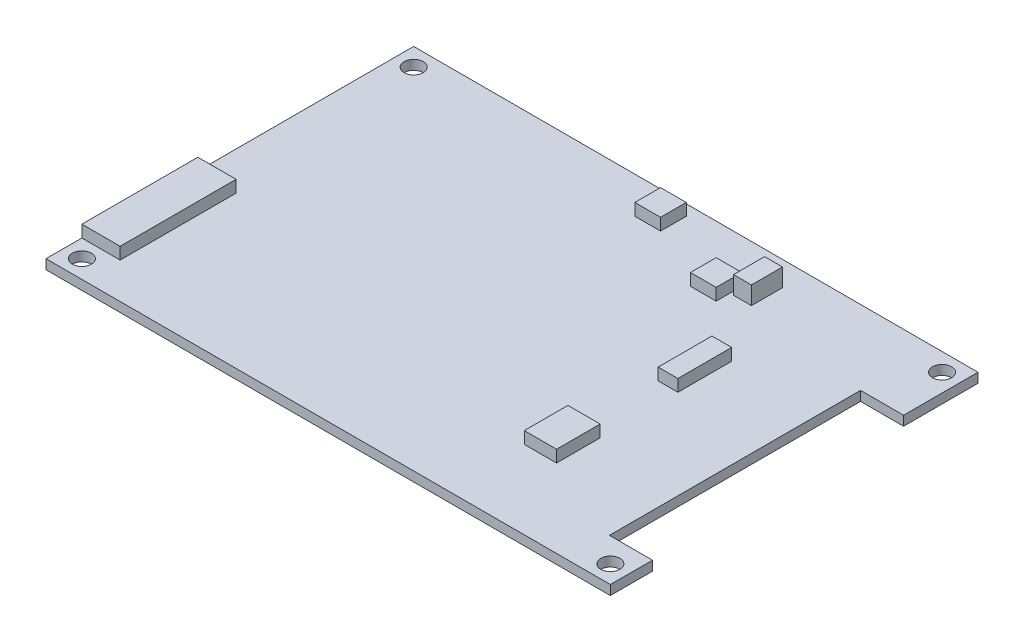
from build123d import *

# Parameters (mm, degrees)
SKETCH_1_R      = 1.6
EXTRUDE_1_DEPTH = 1.6
SKETCH_2_W      = 6.4
SKETCH_2_H      = 19.4
SKETCH_2_W_2    = 5.4
SKETCH_2_H_2    = 7.3
SKETCH_2_W_3    = 3.3
SKETCH_2_H_3    = 9
SKETCH_2_W_4    = 4.3
SKETCH_2_H_4    = 4.3
EXTRUDE_2_DEPTH = 2
SKETCH_3_W      = 3
SKETCH_3_H      = 5.2
EXTRUDE_3_DEPTH = 3


with BuildPart() as part:
    # 草图1 → 凸台-拉伸1 (new body)
    with BuildSketch(Plane(origin=(0, 0, 0), x_dir=(1, 0, 0), z_dir=(0, 1, 0))):
        Polygon((94.4, 0), (0, 0), (0, -61.5), (94.4, -61.5), (94.4, -54.45), (87.2, -54.45), (87.2, -12.45), (94.4, -12.45), align=None)
        with Locations(Location((3, -58.5, 0), (0, 0, 270))):
            Circle(SKETCH_1_R, mode=Mode.SUBTRACT)
        with Locations(Location((91.4, -58.5, 0), (0, 0, 270))):
            Circle(SKETCH_1_R, mode=Mode.SUBTRACT)
        with Locations(Location((3, -3, 0), (0, 0, 270))):
            Circle(SKETCH_1_R, mode=Mode.SUBTRACT)
        with Locations(Location((91.4, -3, 0), (0, 0, 270))):
            Circle(SKETCH_1_R, mode=Mode.SUBTRACT)
    extrude(amount=EXTRUDE_1_DEPTH)

    # 草图2 → 凸台-拉伸2 (add)
    with BuildSketch(Plane(origin=(0, 1.6, 0), x_dir=(1, 0, 0), z_dir=(0, 1, 0))):
        with Locations((3.2, -45.8)):
            Rectangle(SKETCH_2_W, SKETCH_2_H)
        with Locations((69.6, -44.75)):
            Rectangle(SKETCH_2_W_2, SKETCH_2_H_2)
        with Locations((70.55, -23.5)):
            Rectangle(SKETCH_2_W_3, SKETCH_2_H_3)
        with Locations((45.25, -3.95)):
            Rectangle(SKETCH_2_W_4, SKETCH_2_H_4)
        with Locations((60.05, -9.45)):
            Rectangle(SKETCH_2_W_4, SKETCH_2_H_4)
    extrude(amount=EXTRUDE_2_DEPTH)

    # 草图3 → 凸台-拉伸3 (add)
    with BuildSketch(Plane(origin=(0, 1.6, 0), x_dir=(1, 0, 0), z_dir=(0, 1, 0))):
        with Locations((64.3, -6.7)):
            Rectangle(SKETCH_3_W, SKETCH_3_H)
    extrude(amount=EXTRUDE_3_DEPTH)


solid = part.part
